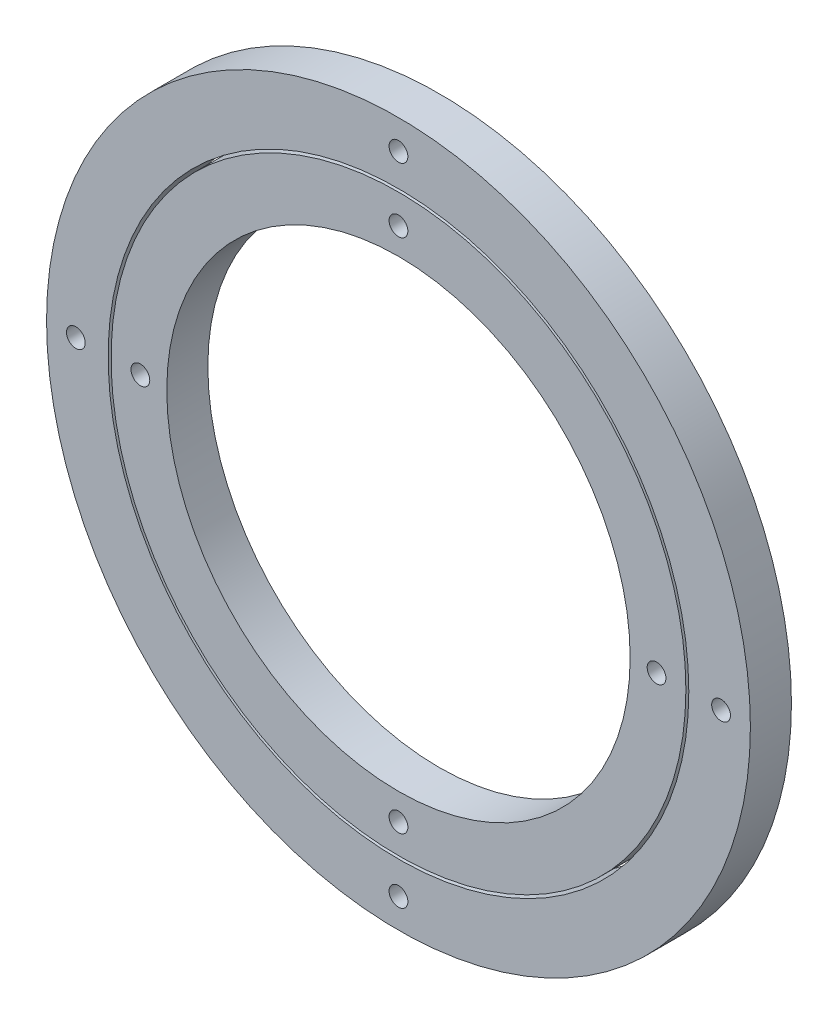
from build123d import *

# Parameters (mm, degrees)
SKETCH_1_R          = 60
SKETCH_1_R_2        = 39.5
SKETCH_1_R_3        = 1.6
EXTRUDE_4_DEPTH     = 7
SKETCH_2_R          = 49.5
SKETCH_2_R_2        = 49
CUT_EXTRUDE_1_DEPTH = 15


with BuildPart() as part:
    # 草图1 → 凸台-拉伸4 (new body)
    with BuildSketch(Plane.XY):
        Circle(SKETCH_1_R)
        Circle(SKETCH_1_R_2, mode=Mode.SUBTRACT)
        with Locations((0, 55)):
            Circle(SKETCH_1_R_3, mode=Mode.SUBTRACT)
        with Locations((55, 0)):
            Circle(SKETCH_1_R_3, mode=Mode.SUBTRACT)
        with Locations((0, -55)):
            Circle(SKETCH_1_R_3, mode=Mode.SUBTRACT)
        with Locations((-55, 0)):
            Circle(SKETCH_1_R_3, mode=Mode.SUBTRACT)
        with Locations((0, 44)):
            Circle(SKETCH_1_R_3, mode=Mode.SUBTRACT)
        with Locations((44, 0)):
            Circle(SKETCH_1_R_3, mode=Mode.SUBTRACT)
        with Locations((0, -44)):
            Circle(SKETCH_1_R_3, mode=Mode.SUBTRACT)
        with Locations((-44, 0)):
            Circle(SKETCH_1_R_3, mode=Mode.SUBTRACT)
    extrude(amount=EXTRUDE_4_DEPTH)

    # 草图2 → 切除-拉伸1 (cut)
    with BuildSketch(Plane.XY):
        Circle(SKETCH_2_R)
        Circle(SKETCH_2_R_2, mode=Mode.SUBTRACT)
    extrude(amount=CUT_EXTRUDE_1_DEPTH, mode=Mode.SUBTRACT)


with BuildPart() as cut_extrude_1_piece_1:
    # of the separate pieces the step leaves, piece 1, a body of its own (cut_extrude_1_pieces)
    add(part.part.solids().sort_by_distance((60, 0, 0))[0])


with BuildPart() as cut_extrude_1_piece_2:
    # of the separate pieces the step leaves, piece 2, a body of its own (cut_extrude_1_pieces)
    add(part.part.solids().sort_by_distance((49, 0, 0))[0])


solid = Compound([cut_extrude_1_piece_1.part, cut_extrude_1_piece_2.part])
